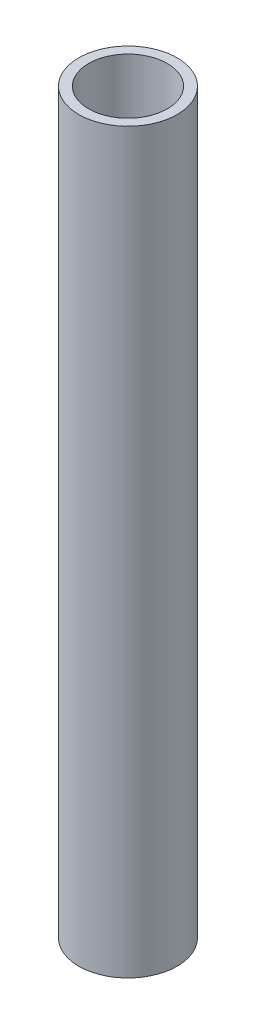
from build123d import *

# Parameters (mm, degrees)
SKETCH1_R           = 10
SKETCH1_R_2         = 8
BOSS_EXTRUDE1_DEPTH = 150


with BuildPart() as part:
    # Sketch1 → Boss-Extrude1 (new body)
    with BuildSketch(Plane(origin=(0, 0, 0), x_dir=(1, 0, 0), z_dir=(0, 1, 0))):
        Circle(SKETCH1_R)
        Circle(SKETCH1_R_2, mode=Mode.SUBTRACT)
    extrude(amount=BOSS_EXTRUDE1_DEPTH)


solid = part.part
